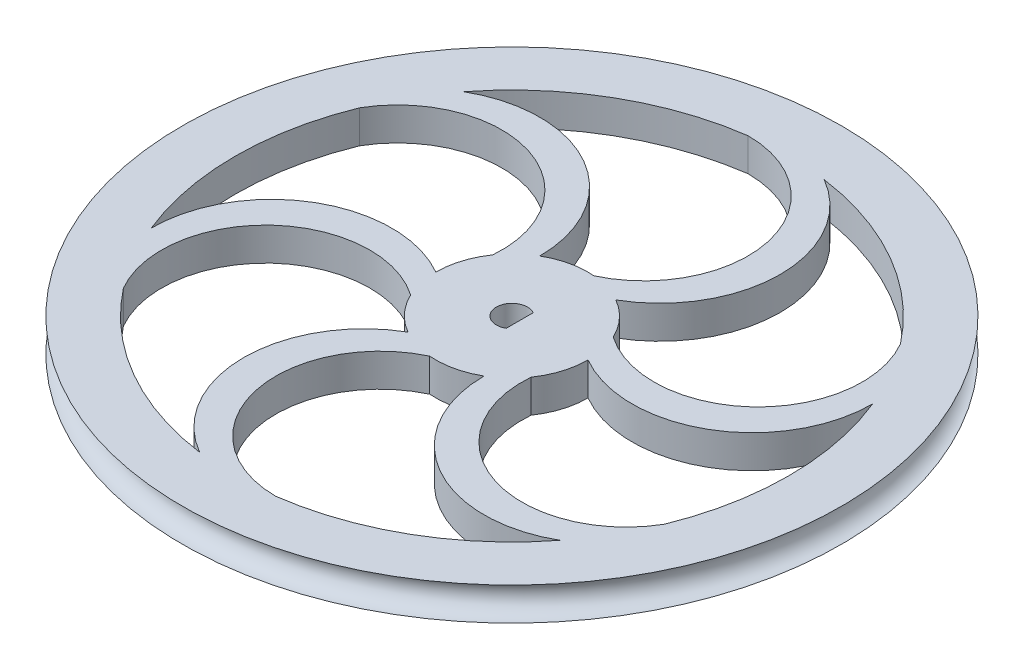
from build123d import *

# Parameters (mm, degrees)
SKETCH1_R           = 31.75
BOSS_EXTRUDE1_DEPTH = 3.175
SKETCH2_R           = 1.5875
CUT_EXTRUDE1_DEPTH  = 46.01339384
SKETCH6_R           = 7.332348419
BOSS_EXTRUDE2_DEPTH = 3.175
CUT_EXTRUDE2_DEPTH  = 46.01339384


with BuildPart() as part:
    # Sketch1 → Boss-Extrude1 (new body)
    with BuildSketch(Plane(origin=(0, 0, 0), x_dir=(1, 0, 0), z_dir=(0, 1, 0))):
        with Locations(Location((0, 0, 0), (0, 0, 270))):
            Circle(SKETCH1_R)
    extrude(amount=BOSS_EXTRUDE1_DEPTH)

    # Sketch2 → Cut-Revolve1 (revolve, cut)
    with BuildSketch(Plane.XY, mode=Mode.PRIVATE) as cut_revolve1_sk:
        with Locations((-31.75, 1.5875)):
            Circle(SKETCH2_R)
    revolve(cut_revolve1_sk.sketch.rotate(Axis((0, 0, 0), (0, 1, 0)), 270), axis=Axis((0, 0, 0), (0, 1, 0)), mode=Mode.SUBTRACT)

    # Sketch5 → Cut-Extrude1 (cut, through all)
    with BuildSketch(Plane(origin=(0, 3.175, 0), x_dir=(1, 0, 0), z_dir=(0, 1, 0))):
        with BuildLine():
            ThreePointArc((-23.660280874, -5.212986442), (-16.648813235, 1.003322249), (-7.332348419, 0))
            ThreePointArc((-7.332348419, 0), (-7.904270057, 10.91410008), (-18.107373639, 14.830903904))
            Line((-18.107373639, 14.830903904), (-26.67, 0))
            Line((-26.67, 0), (-23.660280874, -5.212986442))
        make_face()
        with BuildLine():
            ThreePointArc((-7.315561749, -23.096897519), (-9.193309174, -13.91663408), (-3.666174209, -6.35))
            ThreePointArc((-3.666174209, -6.35), (-13.404022957, -1.388248628), (-21.897626361, -8.265993615))
            Line((-21.897626361, -8.265993615), (-13.335, -23.096897519))
            Line((-13.335, -23.096897519), (-7.315561749, -23.096897519))
        make_face()
        with BuildLine():
            ThreePointArc((16.344719126, -17.883911077), (7.455504061, -14.919956329), (3.666174209, -6.35))
            ThreePointArc((3.666174209, -6.35), (-5.4997529, -12.302348707), (-3.790252722, -23.096897519))
            Line((-3.790252722, -23.096897519), (13.335, -23.096897519))
            Line((13.335, -23.096897519), (16.344719126, -17.883911077))
        make_face()
        with BuildLine():
            ThreePointArc((23.660280874, 5.212986442), (16.648813235, -1.003322249), (7.332348419, 0))
            ThreePointArc((7.332348419, 0), (7.904270057, -10.91410008), (18.107373639, -14.830903904))
            Line((18.107373639, -14.830903904), (26.67, 0))
            Line((26.67, 0), (23.660280874, 5.212986442))
        make_face()
        with BuildLine():
            ThreePointArc((7.315561749, 23.096897519), (9.193309174, 13.91663408), (3.666174209, 6.35))
            ThreePointArc((3.666174209, 6.35), (13.404022957, 1.388248628), (21.897626361, 8.265993615))
            Line((21.897626361, 8.265993615), (13.335, 23.096897519))
            Line((13.335, 23.096897519), (7.315561749, 23.096897519))
        make_face()
        with BuildLine():
            ThreePointArc((-16.344719126, 17.883911077), (-7.455504061, 14.919956329), (-3.666174209, 6.35))
            ThreePointArc((-3.666174209, 6.35), (5.4997529, 12.302348707), (3.790252722, 23.096897519))
            Line((3.790252722, 23.096897519), (-13.335, 23.096897519))
            Line((-13.335, 23.096897519), (-16.344719126, 17.883911077))
        make_face()
        with BuildLine():
            ThreePointArc((-21.044544984, 16.383407045), (-18.775429284, 17.386729294), (-16.344719126, 17.883911077))
            Line((-16.344719126, 17.883911077), (-13.335, 23.096897519))
            ThreePointArc((-13.335, 23.096897519), (-17.514451659, 20.113002836), (-21.044544984, 16.383407045))
        make_face()
        with BuildLine():
            Line((-13.335, 23.096897519), (3.790252722, 23.096897519))
            ThreePointArc((3.790252722, 23.096897519), (0.414884128, 25.549334154), (-3.666174209, 26.41681409))
            ThreePointArc((-3.666174209, 26.41681409), (-8.661145573, 25.224461488), (-13.335, 23.096897519))
        make_face()
        with BuildLine():
            ThreePointArc((3.666174209, 26.41681409), (5.669634616, 24.953363374), (7.315561749, 23.096897519))
            Line((7.315561749, 23.096897519), (13.335, 23.096897519))
            ThreePointArc((13.335, 23.096897519), (8.661145573, 25.224461488), (3.666174209, 26.41681409))
        make_face()
        with BuildLine():
            Line((13.335, 23.096897519), (21.897626361, 8.265993615))
            ThreePointArc((21.897626361, 8.265993615), (22.333814492, 12.415366882), (21.044544984, 16.383407045))
            ThreePointArc((21.044544984, 16.383407045), (17.514451659, 20.113002836), (13.335, 23.096897519))
        make_face()
        with BuildLine():
            ThreePointArc((24.710719194, 10.033407045), (24.4450639, 7.56663408), (23.660280874, 5.212986442))
            Line((23.660280874, 5.212986442), (26.67, 0))
            ThreePointArc((26.67, 0), (26.175597232, 5.111458652), (24.710719194, 10.033407045))
        make_face()
        with BuildLine():
            ThreePointArc((21.044544984, -16.383407045), (18.775429284, -17.386729294), (16.344719126, -17.883911077))
            Line((16.344719126, -17.883911077), (13.335, -23.096897519))
            ThreePointArc((13.335, -23.096897519), (17.514451659, -20.113002836), (21.044544984, -16.383407045))
        make_face()
        with BuildLine():
            Line((13.335, -23.096897519), (-3.790252722, -23.096897519))
            ThreePointArc((-3.790252722, -23.096897519), (-0.414884128, -25.549334154), (3.666174209, -26.41681409))
            ThreePointArc((3.666174209, -26.41681409), (8.661145573, -25.224461488), (13.335, -23.096897519))
        make_face()
        with BuildLine():
            ThreePointArc((-3.666174209, -26.41681409), (-5.669634616, -24.953363374), (-7.315561749, -23.096897519))
            Line((-7.315561749, -23.096897519), (-13.335, -23.096897519))
            ThreePointArc((-13.335, -23.096897519), (-8.661145573, -25.224461488), (-3.666174209, -26.41681409))
        make_face()
        with BuildLine():
            Line((-13.335, -23.096897519), (-21.897626361, -8.265993615))
            ThreePointArc((-21.897626361, -8.265993615), (-22.333814492, -12.415366882), (-21.044544984, -16.383407045))
            ThreePointArc((-21.044544984, -16.383407045), (-17.514451659, -20.113002836), (-13.335, -23.096897519))
        make_face()
        with BuildLine():
            ThreePointArc((-24.710719194, -10.033407045), (-24.4450639, -7.56663408), (-23.660280874, -5.212986442))
            Line((-23.660280874, -5.212986442), (-26.67, 0))
            ThreePointArc((-26.67, 0), (-26.175597232, -5.111458652), (-24.710719194, -10.033407045))
        make_face()
        with BuildLine():
            Line((-26.67, 0), (-18.107373639, 14.830903904))
            ThreePointArc((-18.107373639, 14.830903904), (-21.918930363, 13.133967272), (-24.710719194, 10.033407045))
            ThreePointArc((-24.710719194, 10.033407045), (-26.175597232, 5.111458652), (-26.67, 0))
        make_face()
        with BuildLine():
            Line((26.67, 0), (18.107373639, -14.830903904))
            ThreePointArc((18.107373639, -14.830903904), (21.918930363, -13.133967272), (24.710719194, -10.033407045))
            ThreePointArc((24.710719194, -10.033407045), (26.175597232, -5.111458652), (26.67, 0))
        make_face()
    extrude(amount=-CUT_EXTRUDE1_DEPTH, mode=Mode.SUBTRACT)

    # Sketch6 → Boss-Extrude2 (add)
    with BuildSketch(Plane(origin=(0, 3.175, 0), x_dir=(1, 0, 0), z_dir=(0, 1, 0))):
        Circle(SKETCH6_R)
    extrude(amount=-BOSS_EXTRUDE2_DEPTH)

    # Sketch7 → Cut-Extrude2 (cut, through all)
    with BuildSketch(Plane(origin=(0, 3.175, 0), x_dir=(1, 0, 0), z_dir=(0, 1, 0))):
        with BuildLine():
            Line((0.75, 1.299038106), (0.75, -1.299038106))
            ThreePointArc((0.75, -1.299038106), (-1.5, 0), (0.75, 1.299038106))
        make_face()
    extrude(amount=-CUT_EXTRUDE2_DEPTH, mode=Mode.SUBTRACT)


solid = part.part
